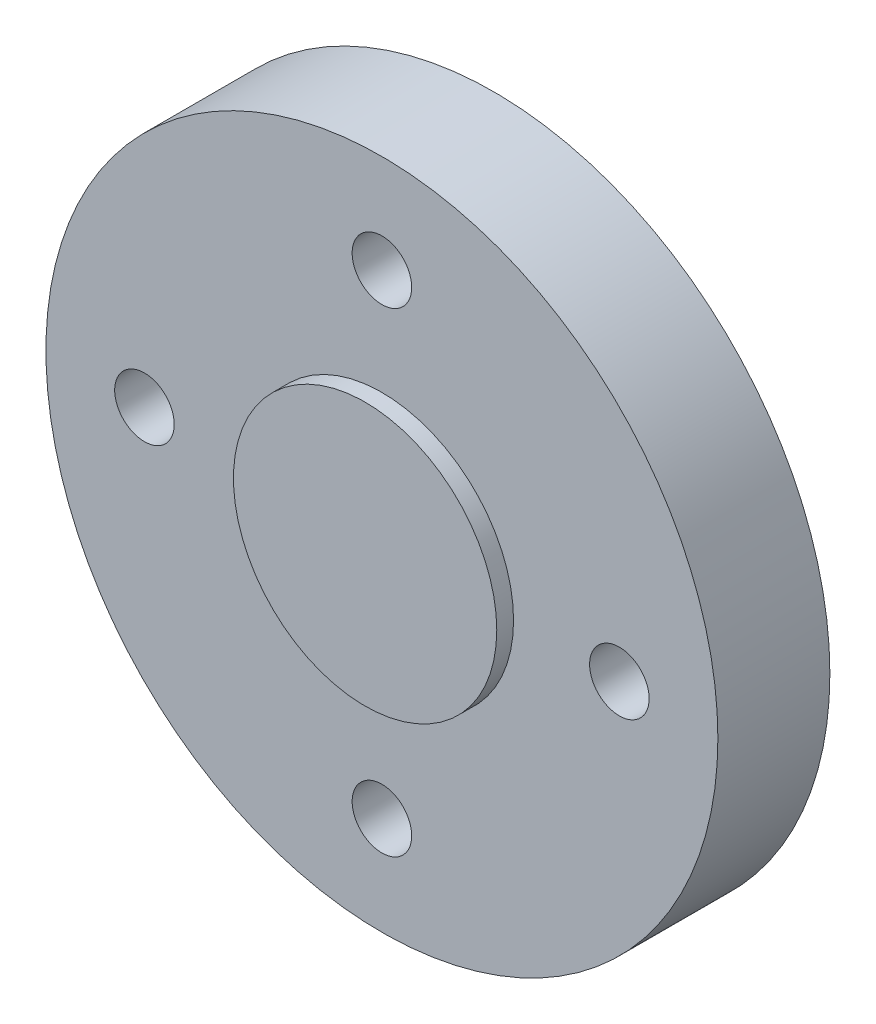
from build123d import *

# Parameters (mm, degrees)
SKETCH1_R           = 30
BOSS_EXTRUDE1_DEPTH = 10
SKETCH2_R           = 11.755971956
BOSS_EXTRUDE3_DEPTH = 1.5
SKETCH5_R           = 2.658250205
CUT_EXTRUDE4_DEPTH  = 26
SKETCH6_R           = 10.634150048
CUT_EXTRUDE5_DEPTH  = 9.5


with BuildPart() as part:
    # Sketch1 → Boss-Extrude1 (new body)
    with BuildSketch(Plane.XY):
        Circle(SKETCH1_R)
    extrude(amount=BOSS_EXTRUDE1_DEPTH)

    # Sketch2 → Boss-Extrude3 (add, symmetric)
    with BuildSketch(Plane.XY.offset(10)):
        Circle(SKETCH2_R)
    extrude(amount=BOSS_EXTRUDE3_DEPTH, both=True)

    # Sketch5 → Cut-Extrude4 (cut)
    with BuildSketch(Plane.XY.offset(10)):
        with Locations((0, -21.20336232)):
            Circle(SKETCH5_R)
        with Locations((-21.20336232, 0)):
            Circle(SKETCH5_R)
        with Locations((0, 21.20336232)):
            Circle(SKETCH5_R)
        with Locations((21.20336232, 0)):
            Circle(SKETCH5_R)
    extrude(amount=-CUT_EXTRUDE4_DEPTH, mode=Mode.SUBTRACT)

    # Sketch6 → Cut-Extrude5 (cut)
    with BuildSketch(Plane(origin=(0, 0, 0), x_dir=(-1, 0, 0), z_dir=(0, 0, -1))):
        Circle(SKETCH6_R)
    extrude(amount=-CUT_EXTRUDE5_DEPTH, mode=Mode.SUBTRACT)


solid = part.part
